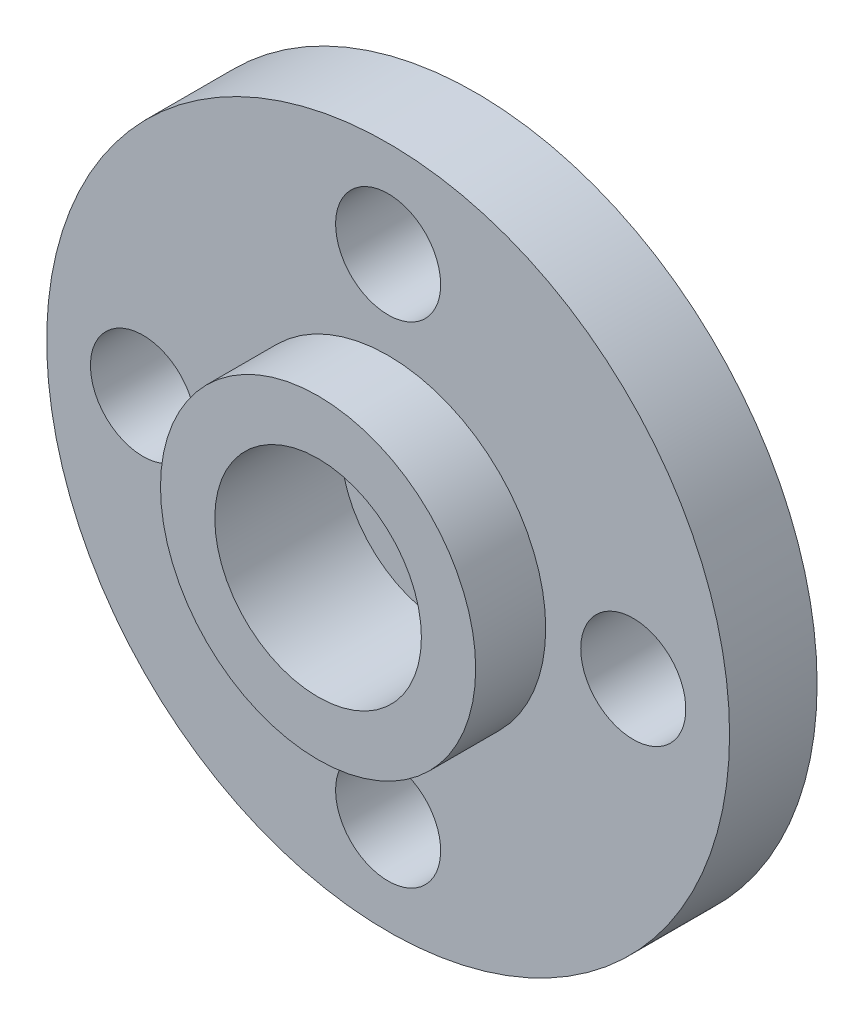
from build123d import *

# Parameters (mm, degrees)
SKETCH_1_R               = 9.75
EXTRUDE_1_DEPTH          = 2.5
SKETCH_2_R               = 4.5
EXTRUDE_2_DEPTH          = 2
SKETCH_3_R               = 2.95
CUT_EXTRUDE_1_DEPTH      = 3.6
SKETCH_4_R               = 1.6
CUT_EXTRUDE_2_DEPTH      = 3.6
SKETCH_5_R               = 1.5
CUT_EXTRUDE_3_DEPTH      = 15.013386457
PATTERN_CIRCULAR_1_COUNT = 4


with BuildPart() as part:
    # 草图1 → 凸台-拉伸1 (new body)
    with BuildSketch(Plane.XY):
        Circle(SKETCH_1_R)
    extrude(amount=EXTRUDE_1_DEPTH)

    # 草图2 → 凸台-拉伸2 (add)
    with BuildSketch(Plane.XY.offset(2.5)):
        Circle(SKETCH_2_R)
    extrude(amount=EXTRUDE_2_DEPTH)

    # 草图3 → 切除-拉伸1 (cut)
    with BuildSketch(Plane.XY.offset(4.5)):
        Circle(SKETCH_3_R)
    extrude(amount=-CUT_EXTRUDE_1_DEPTH, mode=Mode.SUBTRACT)

    # 草图4 → 切除-拉伸2 (cut)
    with BuildSketch(Plane(origin=(0, 0, 0), x_dir=(-1, 0, 0), z_dir=(0, 0, -1))):
        Circle(SKETCH_4_R)
    extrude(amount=-CUT_EXTRUDE_2_DEPTH, mode=Mode.SUBTRACT)

    # 草图5 → 切除-拉伸3 (cut, through all)
    with BuildSketch(Plane.XY.offset(2.5)):
        with Locations((-7, 0)):
            Circle(SKETCH_5_R)
    cut_extrude_3 = extrude(amount=-CUT_EXTRUDE_3_DEPTH, mode=Mode.SUBTRACT)

    # 阵列(圆周)1: 切除-拉伸3 ×4 about axis
    pattern_circular_1_axis = Axis((0, 0, 0), (0, 0, 1))
    for i in range(1, PATTERN_CIRCULAR_1_COUNT):
        add(cut_extrude_3.rotate(pattern_circular_1_axis, i * 360 / PATTERN_CIRCULAR_1_COUNT), mode=Mode.SUBTRACT)


solid = part.part
